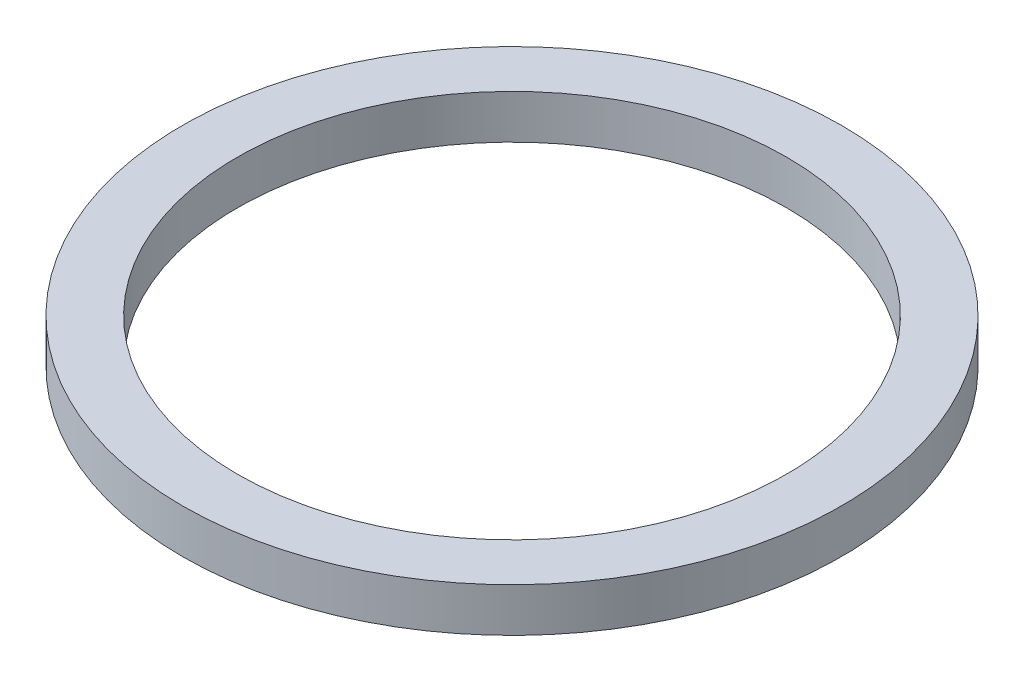
from build123d import *

# Parameters (mm, degrees)
SKETCH1_R           = 15
SKETCH1_R_2         = 12.5
BOSS_EXTRUDE1_DEPTH = 2


with BuildPart() as part:
    # Sketch1 → Boss-Extrude1 (new body)
    with BuildSketch(Plane(origin=(0, 0, 0), x_dir=(1, 0, 0), z_dir=(0, 1, 0))):
        with Locations(Location((0, 0, 0), (0, 0, 270))):
            Circle(SKETCH1_R)
        with Locations(Location((0, 0, 0), (0, 0, 270))):
            Circle(SKETCH1_R_2, mode=Mode.SUBTRACT)
    extrude(amount=BOSS_EXTRUDE1_DEPTH)


solid = part.part
